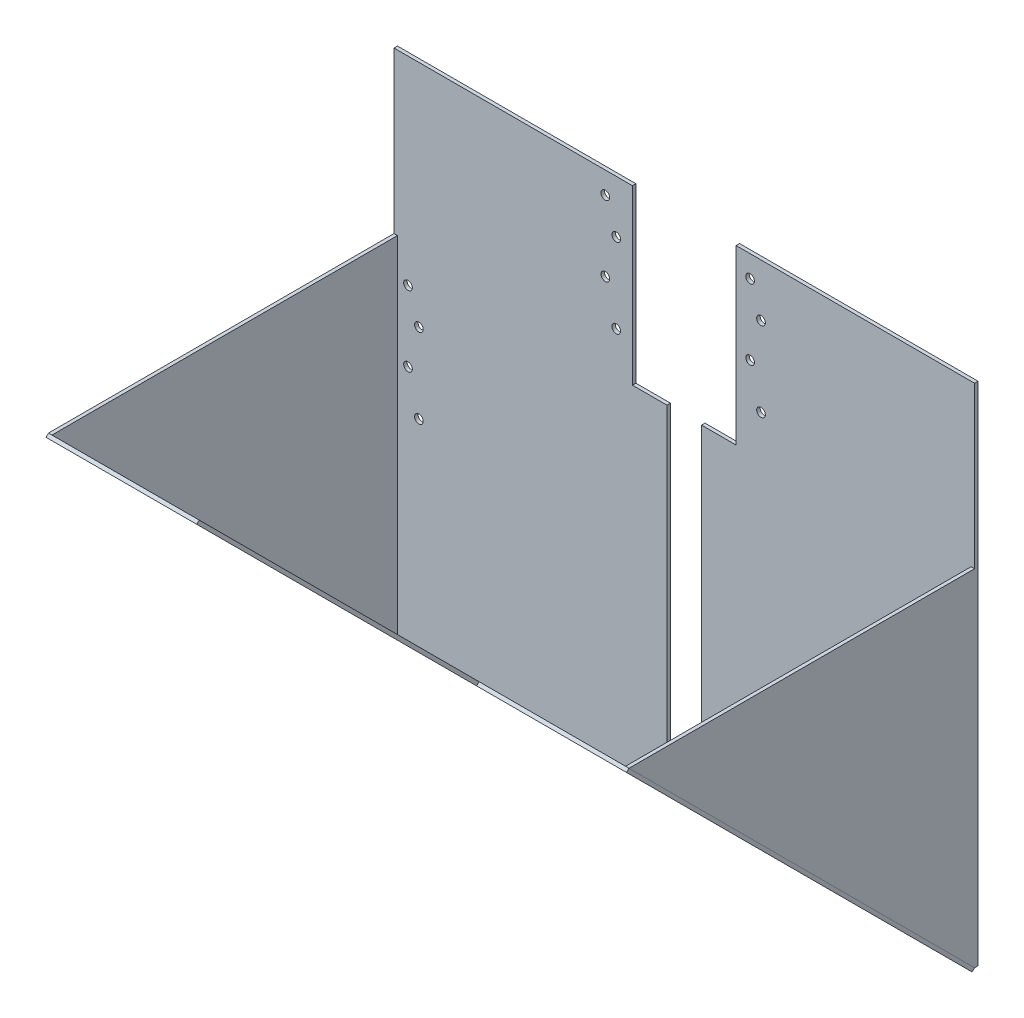
from build123d import *

# Parameters (mm, degrees)
SKETCH_1_R        = 2.5
EXTRUDE_2_DEPTH   = 2
EXTRUDE_2_2_DEPTH = 2
EXTRUDE_5_DEPTH   = 2
EXTRUDE_6_DEPTH   = 2
EXTRUDE_7_DEPTH   = 2
EXTRUDE_7_2_DEPTH = 2


with BuildPart() as part:
    # 草图1 → 凸台-拉伸2 (new body)
    with BuildSketch(Plane.XY):
        Polygon((2433.85566646, 2029.703654003), (2433.85566646, 1836.703654003), (2275.85566646, 1836.703654003), (2275.85566646, 2129.703654003), (2413.85566646, 2129.703654003), (2413.85566646, 2029.703654003), align=None)
        with Locations((2404.475937528, 2099.303654003)):
            Circle(SKETCH_1_R, mode=Mode.SUBTRACT)
        with Locations((2404.475937528, 2053.283382936)):
            Circle(SKETCH_1_R, mode=Mode.SUBTRACT)
        with Locations((2398.15566646, 2076.303654003)):
            Circle(SKETCH_1_R, mode=Mode.SUBTRACT)
        with Locations((2398.15566646, 2117.103654003)):
            Circle(SKETCH_1_R, mode=Mode.SUBTRACT)
        with Locations((2290.275937528, 1997.003654003)):
            Circle(SKETCH_1_R, mode=Mode.SUBTRACT)
        with Locations((2290.275937528, 1950.983382936)):
            Circle(SKETCH_1_R, mode=Mode.SUBTRACT)
        with Locations((2283.95566646, 1974.003654003)):
            Circle(SKETCH_1_R, mode=Mode.SUBTRACT)
        with Locations((2283.95566646, 2014.803654003)):
            Circle(SKETCH_1_R, mode=Mode.SUBTRACT)
    extrude(amount=EXTRUDE_2_DEPTH)

    # 草图6 → 凸台-拉伸6 (add)
    with BuildSketch(Plane.ZY.offset(-2275.85566646)):
        Polygon((2, 1836.703654003), (2, 2036.703654003), (202, 2036.703654003), align=None)
    extrude(amount=-EXTRUDE_6_DEPTH)


with BuildPart() as body_2:
    # 草图1 → Extrude 2 2 (new body)
    with BuildSketch(Plane.XY):
        Polygon((2473.85566646, 2129.703654003), (2473.85566646, 2029.703654003), (2453.85566646, 2029.703654003), (2453.85566646, 1836.703654003), (2611.85566646, 1836.703654003), (2611.85566646, 2129.703654003), align=None)
        with Locations((2488.275937528, 2099.303654003)):
            Circle(SKETCH_1_R, mode=Mode.SUBTRACT)
        with Locations((2488.275937528, 2053.283382936)):
            Circle(SKETCH_1_R, mode=Mode.SUBTRACT)
        with Locations((2481.95566646, 2076.303654003)):
            Circle(SKETCH_1_R, mode=Mode.SUBTRACT)
        with Locations((2481.95566646, 2117.103654003)):
            Circle(SKETCH_1_R, mode=Mode.SUBTRACT)
        with Locations((2602.475937528, 1997.003654003)):
            Circle(SKETCH_1_R, mode=Mode.SUBTRACT)
        with Locations((2602.475937528, 1950.983382936)):
            Circle(SKETCH_1_R, mode=Mode.SUBTRACT)
        with Locations((2596.15566646, 1974.003654003)):
            Circle(SKETCH_1_R, mode=Mode.SUBTRACT)
        with Locations((2596.15566646, 2014.803654003)):
            Circle(SKETCH_1_R, mode=Mode.SUBTRACT)
    extrude(amount=EXTRUDE_2_2_DEPTH)

    # 草图5 → 凸台-拉伸5 (add)
    with BuildSketch(Plane(origin=(2611.85566646, 0, 0), x_dir=(0, 0, -1), z_dir=(1, 0, 0))):
        Polygon((-2, 1836.703654003), (-2, 2036.703654003), (-202, 2036.703654003), align=None)
    extrude(amount=-EXTRUDE_5_DEPTH)


with BuildPart() as body_3:
    # 草图7 → 凸台-拉伸7 (new body)
    with BuildSketch(Plane(origin=(0, 917.351827001, -917.351827001), x_dir=(1, 0, 0), z_dir=(0, -0.7071067811865472, 0.7071067811865479))):
        Polygon((2417.85566646, 1300.159822338), (2417.85566646, 1350.159822338), (2362.85566646, 1582.657469875), (2275.85566646, 1583.002534812), (2275.85566646, 1300.159822338), align=None)
    extrude(amount=EXTRUDE_7_DEPTH)


with BuildPart() as body_4:
    # 草图7 → Extrude 7 2 (new body)
    with BuildSketch(Plane(origin=(0, 917.351827001, -917.351827001), x_dir=(1, 0, 0), z_dir=(0, -0.7071067811865472, 0.7071067811865479))):
        Polygon((2469.85566646, 1300.159822338), (2469.85566646, 1350.159822338), (2524.85566646, 1582.657469875), (2611.85566646, 1583.002534812), (2611.85566646, 1300.159822338), align=None)
    extrude(amount=EXTRUDE_7_2_DEPTH)


solid = Compound([part.part, body_2.part, body_3.part, body_4.part])
